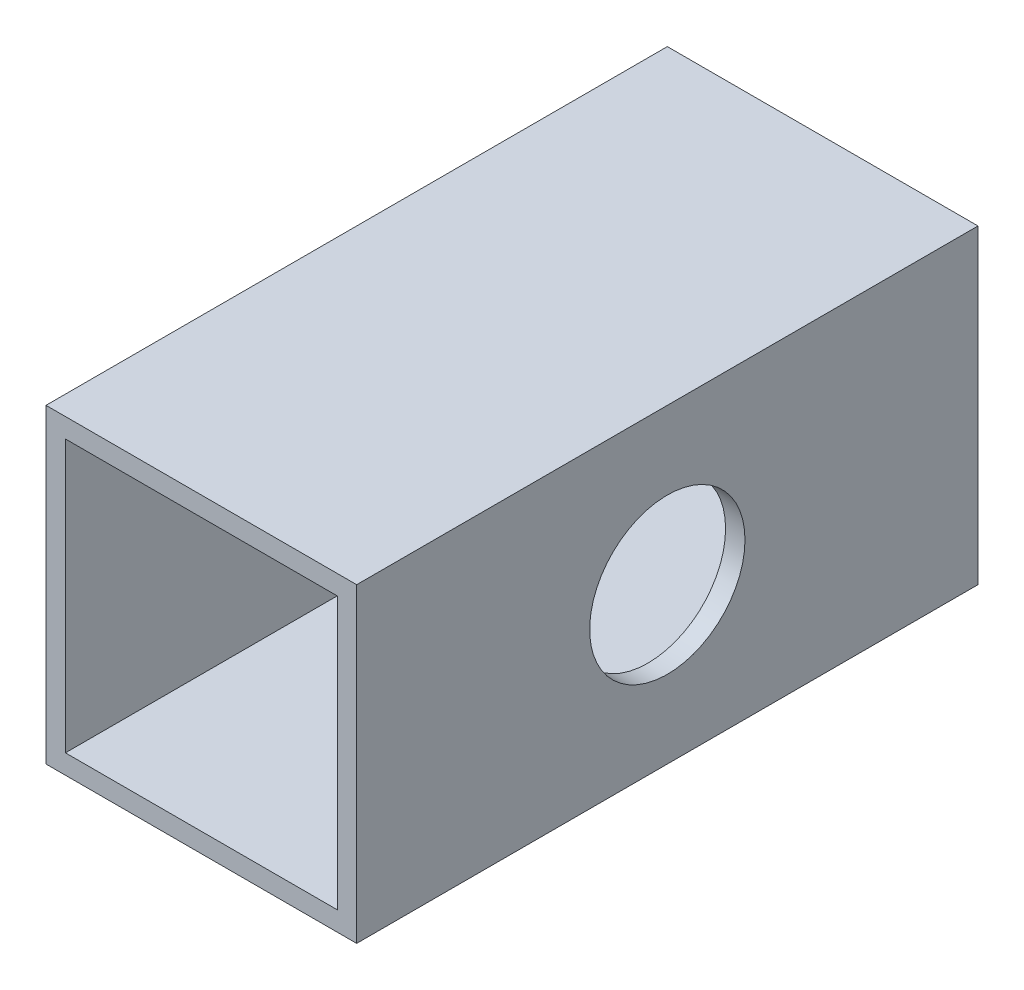
from build123d import *

# Parameters (mm, degrees)
SKETCH1_W           = 25.4
SKETCH1_H           = 25.4
SKETCH1_W_2         = 22.225
SKETCH1_H_2         = 22.225
BOSS_EXTRUDE1_DEPTH = 50.8
SKETCH2_R           = 6.35
CUT_EXTRUDE2_DEPTH  = 59.198711326


with BuildPart() as part:
    # Sketch1 → Boss-Extrude1 (new body)
    with BuildSketch(Plane.XY):
        Rectangle(SKETCH1_W, SKETCH1_H)
        Rectangle(SKETCH1_W_2, SKETCH1_H_2, mode=Mode.SUBTRACT)
    extrude(amount=BOSS_EXTRUDE1_DEPTH)

    # Sketch2 → Cut-Extrude2 (cut, through all)
    with BuildSketch(Plane(origin=(12.7, 0, 0), x_dir=(0, 0, -1), z_dir=(1, 0, 0))):
        with Locations((-25.4, 0)):
            Circle(SKETCH2_R)
    extrude(amount=-CUT_EXTRUDE2_DEPTH, mode=Mode.SUBTRACT)


solid = part.part
